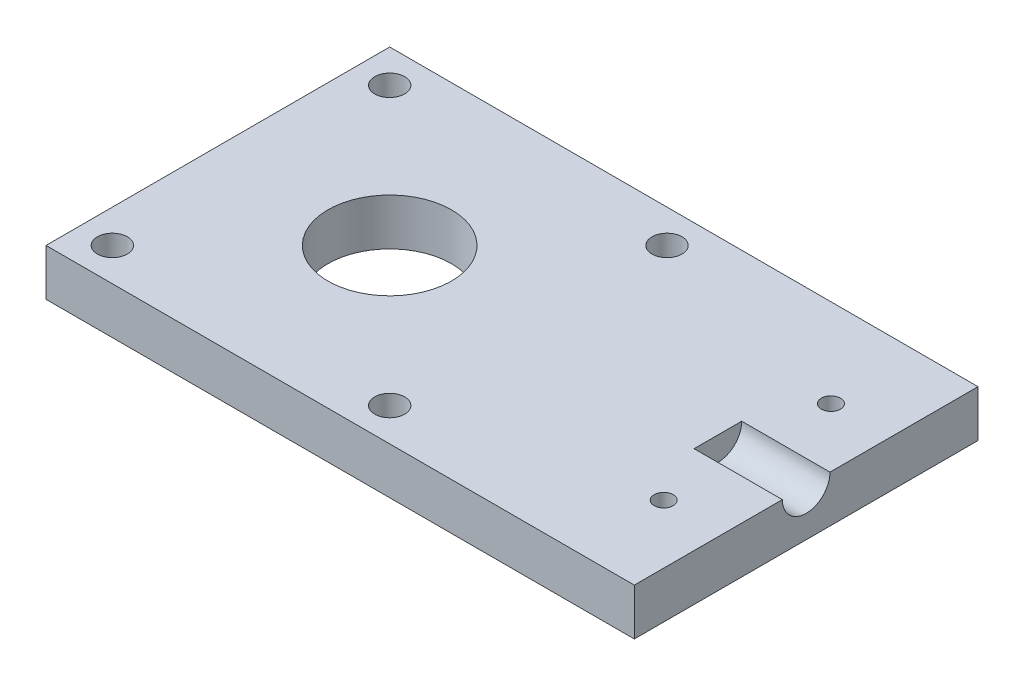
from build123d import *

# Parameters (mm, degrees)
SKETCH1_W           = 100
SKETCH1_H           = 58.42
SKETCH1_R           = 2.55
SKETCH1_R_2         = 1.625
SKETCH1_R_3         = 10.5
BOSS_EXTRUDE1_DEPTH = 7.9375
SKETCH2_R           = 4.05
CUT_EXTRUDE1_DEPTH  = 15


with BuildPart() as part:
    # Sketch1 → Boss-Extrude1 (new body)
    with BuildSketch(Plane.XZ.offset(110.068674648)):
        with Locations((45.506748586, 71.609111908)):
            Rectangle(SKETCH1_W, SKETCH1_H)
        with Locations(Location((1.146748586, 95.179111908, 0), (0, 0, 270))):
            Circle(SKETCH1_R, mode=Mode.SUBTRACT)
        with Locations(Location((1.146748586, 48.039111908, 0), (0, 0, 270))):
            Circle(SKETCH1_R, mode=Mode.SUBTRACT)
        with Locations(Location((48.286748586, 48.039111908, 0), (0, 0, 270))):
            Circle(SKETCH1_R, mode=Mode.SUBTRACT)
        with Locations(Location((48.286748586, 95.179111908, 0), (0, 0, 270))):
            Circle(SKETCH1_R, mode=Mode.SUBTRACT)
        with Locations(Location((85.506748586, 85.819111908, 0), (0, 0, 270))):
            Circle(SKETCH1_R_2, mode=Mode.SUBTRACT)
        with Locations(Location((85.506748586, 57.399111908, 0), (0, 0, 270))):
            Circle(SKETCH1_R_2, mode=Mode.SUBTRACT)
        with Locations(Location((24.716748586, 71.609111908, 0), (0, 0, 270))):
            Circle(SKETCH1_R_3, mode=Mode.SUBTRACT)
    extrude(amount=BOSS_EXTRUDE1_DEPTH)

    # Sketch2 → Cut-Extrude1 (cut)
    with BuildSketch(Plane(origin=(95.506748586, -1.5875, 13.918119016), x_dir=(0, 0, -1), z_dir=(1, 0, 0))):
        with Locations((-57.690992892, -108.481174648)):
            Circle(SKETCH2_R)
    extrude(amount=-CUT_EXTRUDE1_DEPTH, mode=Mode.SUBTRACT)


solid = part.part
